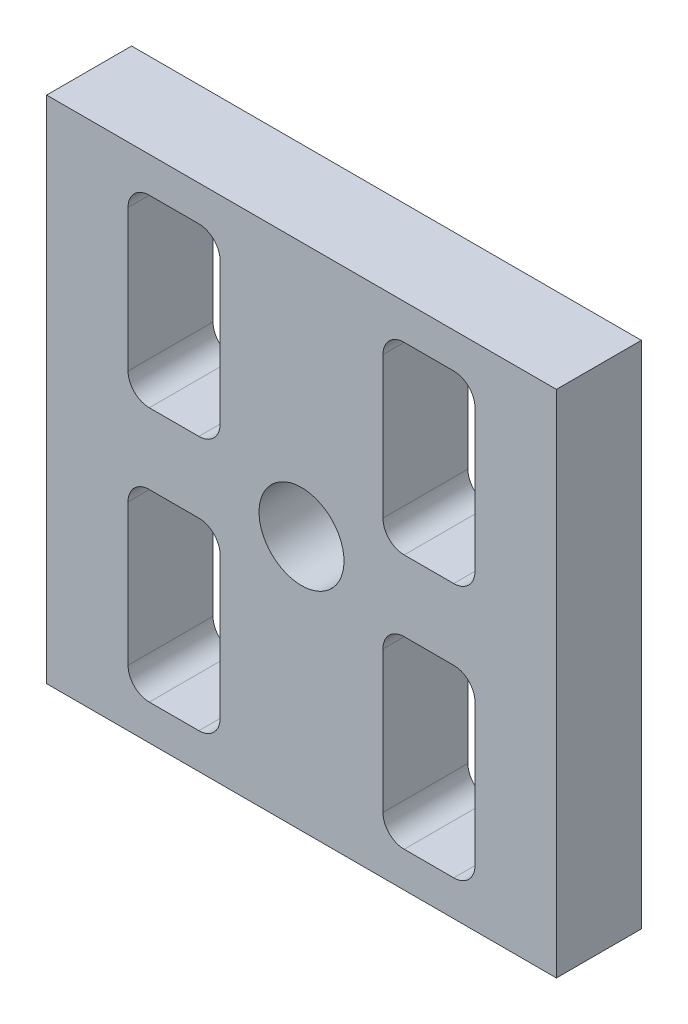
from build123d import *

# Parameters (mm, degrees)
MODEL_W                 = 18
MODEL_H                 = 18
MODEL_R                 = 1.5
SALIENTE_EXTRUIR1_DEPTH = 3


with BuildPart() as part:
    # Model → Saliente-Extruir1 (new body)
    with BuildSketch(Plane.XY):
        with Locations((199.835922194, 170.333196305)):
            Rectangle(MODEL_W, MODEL_H)
        with Locations((199.835922194, 170.333196305)):
            Circle(MODEL_R, mode=Mode.SUBTRACT)
        with BuildLine():
            Line((202.710922194, 172.333196305), (202.710922194, 177.333196305))
            ThreePointArc((202.710922194, 177.333196305), (202.930592108, 177.86352639), (203.460922194, 178.083196305))
            Line((203.460922194, 178.083196305), (205.210922194, 178.083196305))
            ThreePointArc((205.210922194, 178.083196305), (205.74125228, 177.86352639), (205.960922194, 177.333196305))
            Line((205.960922194, 177.333196305), (205.960922194, 172.333196305))
            ThreePointArc((205.960922194, 172.333196305), (205.74125228, 171.802866219), (205.210922194, 171.583196305))
            Line((205.210922194, 171.583196305), (203.460922194, 171.583196305))
            ThreePointArc((203.460922194, 171.583196305), (202.930592108, 171.802866219), (202.710922194, 172.333196305))
        make_face(mode=Mode.SUBTRACT)
        with BuildLine():
            Line((205.960922194, 168.333196305), (205.960922194, 163.333196305))
            ThreePointArc((205.960922194, 163.333196305), (205.74125228, 162.802866219), (205.210922194, 162.583196305))
            Line((205.210922194, 162.583196305), (203.460922194, 162.583196305))
            ThreePointArc((203.460922194, 162.583196305), (202.930592108, 162.802866219), (202.710922194, 163.333196305))
            Line((202.710922194, 163.333196305), (202.710922194, 168.333196305))
            ThreePointArc((202.710922194, 168.333196305), (202.930592108, 168.86352639), (203.460922194, 169.083196305))
            Line((203.460922194, 169.083196305), (205.210922194, 169.083196305))
            ThreePointArc((205.210922194, 169.083196305), (205.74125228, 168.86352639), (205.960922194, 168.333196305))
        make_face(mode=Mode.SUBTRACT)
        with BuildLine():
            Line((196.960922194, 168.333196305), (196.960922194, 163.333196305))
            ThreePointArc((196.960922194, 163.333196305), (196.74125228, 162.802866219), (196.210922194, 162.583196305))
            Line((196.210922194, 162.583196305), (194.460922194, 162.583196305))
            ThreePointArc((194.460922194, 162.583196305), (193.930592108, 162.802866219), (193.710922194, 163.333196305))
            Line((193.710922194, 163.333196305), (193.710922194, 168.333196305))
            ThreePointArc((193.710922194, 168.333196305), (193.930592108, 168.86352639), (194.460922194, 169.083196305))
            Line((194.460922194, 169.083196305), (196.210922194, 169.083196305))
            ThreePointArc((196.210922194, 169.083196305), (196.74125228, 168.86352639), (196.960922194, 168.333196305))
        make_face(mode=Mode.SUBTRACT)
        with BuildLine():
            Line((196.960922194, 177.333196305), (196.960922194, 172.333196305))
            ThreePointArc((196.960922194, 172.333196305), (196.74125228, 171.802866219), (196.210922194, 171.583196305))
            Line((196.210922194, 171.583196305), (194.460922194, 171.583196305))
            ThreePointArc((194.460922194, 171.583196305), (193.930592108, 171.802866219), (193.710922194, 172.333196305))
            Line((193.710922194, 172.333196305), (193.710922194, 177.333196305))
            ThreePointArc((193.710922194, 177.333196305), (193.930592108, 177.86352639), (194.460922194, 178.083196305))
            Line((194.460922194, 178.083196305), (196.210922194, 178.083196305))
            ThreePointArc((196.210922194, 178.083196305), (196.74125228, 177.86352639), (196.960922194, 177.333196305))
        make_face(mode=Mode.SUBTRACT)
    extrude(amount=SALIENTE_EXTRUIR1_DEPTH)


solid = part.part
